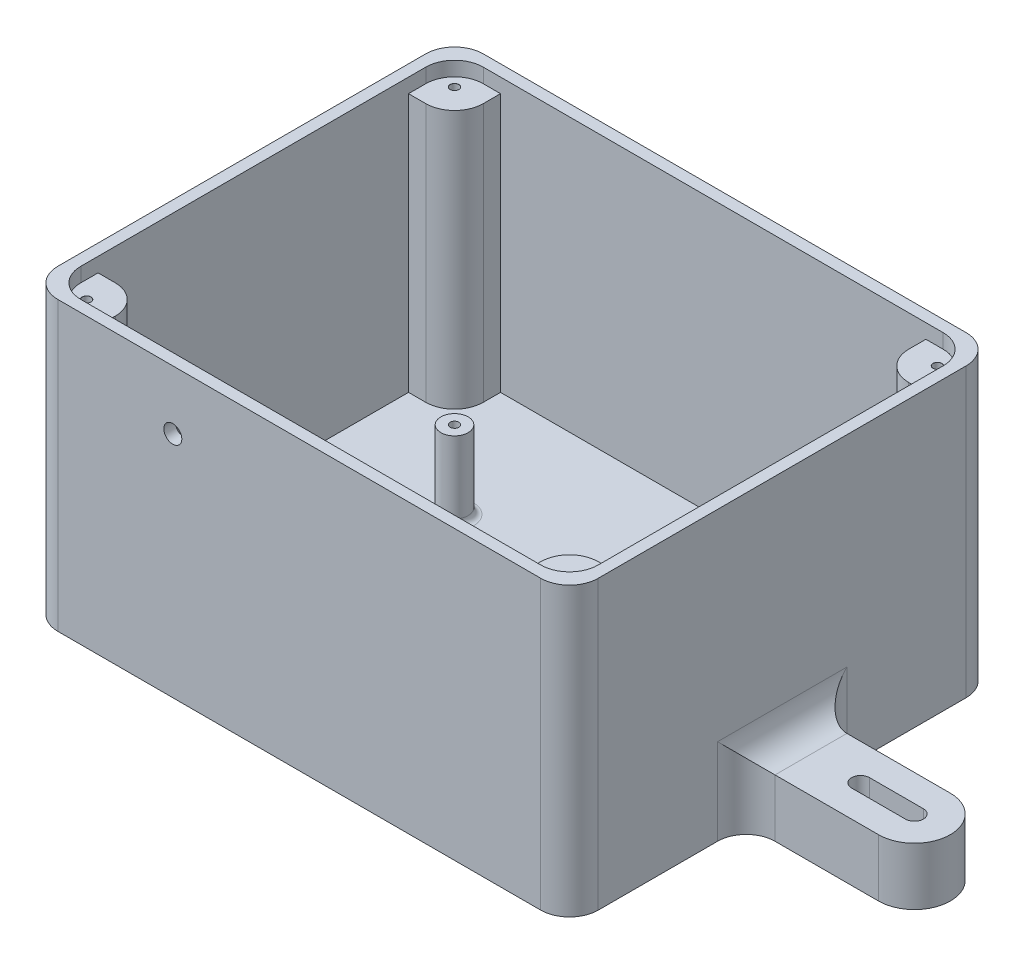
from build123d import *

# Parameters (mm, degrees)
ESBO_O1_W                                  = 4.75
ESBO_O1_H                                  = 1
REVOLU_O1_ANGLE                            = 180
ESBO_O2_W                                  = 9.5
ESBO_O2_H                                  = 74
RESSALTO_EXTRUS_O1_DEPTH                   = 8.75
ESBO_O3_W                                  = 8.75
ESBO_O3_H                                  = 73
CORTE_EXTRUS_O1_DEPTH                      = 1.5
ESBO_O4_W                                  = 8
ESBO_O4_H                                  = 73
CORTE_EXTRUS_O2_DEPTH                      = 4.75
ESBO_O5_W                                  = 4
ESBO_O5_H                                  = 68
RESSALTO_EXTRUS_O2_DEPTH                   = 52
ESBO_O6_W                                  = 4
ESBO_O6_H                                  = 74
RESSALTO_EXTRUS_O3_DEPTH                   = 80
ESBO_O7_W                                  = 4
ESBO_O7_H                                  = 74
RESSALTO_EXTRUS_O4_DEPTH                   = 40
ESBO_O8_W                                  = 144
ESBO_O8_H                                  = 74
RESSALTO_EXTRUS_O5_DEPTH                   = 4
ESBO_O9_W                                  = 144
ESBO_O9_H                                  = 74
RESSALTO_EXTRUS_O6_DEPTH                   = 4
ESBO_O10_W                                 = 188
ESBO_O10_H                                 = 74
RESSALTO_EXTRUS_O7_DEPTH                   = 4
ESBO_O11_W                                 = 188
ESBO_O11_H                                 = 148
RESSALTO_EXTRUS_O8_DEPTH                   = 26
CORTE_EXTRUS_O3_DEPTH                      = 21
RESSALTO_EXTRUS_O9_DEPTH                   = 20
CORTE_EXTRUS_O4_DEPTH                      = 268.847437919
RESSALTO_EXTRUS_O10_DEPTH                  = 20
CORTE_EXTRUS_O5_DEPTH                      = 262.040705638
ESBO_O17_W                                 = 16
ESBO_O17_H                                 = 16
RESSALTO_EXTRUS_O11_DEPTH                  = 90
ESBO_O18_W                                 = 16
ESBO_O18_H                                 = 16
RESSALTO_EXTRUS_O12_DEPTH                  = 90
ESBO_O19_W                                 = 16
ESBO_O19_H                                 = 16
RESSALTO_EXTRUS_O13_DEPTH                  = 90
ESBO_O20_W                                 = 16
ESBO_O20_H                                 = 16
RESSALTO_EXTRUS_O14_DEPTH                  = 90
RESSALTO_EXTRUS_O15_DEPTH                  = 22
ESBO_O22_W                                 = 4.75
ESBO_O22_H                                 = 22
FURO_DE_DI_METRO_3_0_3_1_D                 = 3
FURO_DE_DI_METRO_3_0_3_1_DEPTH             = 15
FURO_DE_DI_METRO_3_0_3_1_TIP               = 0.901290929
FURO_DE_DI_METRO_3_0_3_2_D                 = 3
FURO_DE_DI_METRO_3_0_3_2_DEPTH             = 15
FURO_DE_DI_METRO_3_0_3_2_TIP               = 0.901290929
BROCA_DE_ROSQUEAR_PARA_HELICOIDE_M61_D     = 6.25
BROCA_DE_ROSQUEAR_PARA_HELICOIDE_M61_DEPTH = 4
CHANFRO1_SIZE                              = 0.025
FILETE1_R                                  = 2
FILETE2_R                                  = 10
ESBO_O35_W                                 = 4.75
ESBO_O35_H                                 = 22
FILETE3_R                                  = 2
ESBO_O43_W                                 = 52
ESBO_O43_H                                 = 6
RESSALTO_EXTRUS_O16_DEPTH                  = 4
ESBO_O44_R                                 = 4.75
ESBO_O44_R_2                               = 1.525
RESSALTO_EXTRUS_O17_DEPTH                  = 5


with BuildPart() as part:
    # Esboço1 → Revolução1 (revolve)
    with BuildSketch(Plane.XY.offset(-4.75)):
        with Locations((97.625, 26.5)):
            Rectangle(ESBO_O1_W, ESBO_O1_H)
    revolve(axis=Axis((95.25, 27, -4.75), (0, 1, 0)), revolution_arc=REVOLU_O1_ANGLE)

    # Esboço2 → Ressalto-extrusão1 (add)
    with BuildSketch(Plane.XY.offset(-4.75)):
        with Locations((95.25, 63)):
            Rectangle(ESBO_O2_W, ESBO_O2_H)
    extrude(amount=RESSALTO_EXTRUS_O1_DEPTH)

    # Esboço3 → Corte-extrusão1 (cut)
    with BuildSketch(Plane.ZY.offset(-90.5)):
        with Locations((-0.375, 63.5)):
            Rectangle(ESBO_O3_W, ESBO_O3_H)
    extrude(amount=-CORTE_EXTRUS_O1_DEPTH, mode=Mode.SUBTRACT)

    # Esboço4 → Corte-extrusão2 (cut)
    with BuildSketch(Plane(origin=(0, 0, -4.75), x_dir=(-1, 0, 0), z_dir=(0, 0, -1))):
        with Locations((-96, 63.5)):
            Rectangle(ESBO_O4_W, ESBO_O4_H)
    extrude(amount=-CORTE_EXTRUS_O2_DEPTH, mode=Mode.SUBTRACT)

    # Esboço5 → Ressalto-extrusão2 (add)
    with BuildSketch(Plane.ZY.offset(-92)):
        with Locations((2, 66)):
            Rectangle(ESBO_O5_W, ESBO_O5_H)
    extrude(amount=RESSALTO_EXTRUS_O2_DEPTH)

    # Esboço6 → Ressalto-extrusão3 (add)
    with BuildSketch(Plane.ZY.offset(-40)):
        with Locations((2, 63)):
            Rectangle(ESBO_O6_W, ESBO_O6_H)
    extrude(amount=RESSALTO_EXTRUS_O3_DEPTH)

    # Esboço7 → Ressalto-extrusão4 (add)
    with BuildSketch(Plane(origin=(100, 0, 0), x_dir=(0, 0, -1), z_dir=(1, 0, 0))):
        with Locations((-2, 63)):
            Rectangle(ESBO_O7_W, ESBO_O7_H)
    extrude(amount=RESSALTO_EXTRUS_O4_DEPTH)

    # Esboço8 → Ressalto-extrusão5 (add)
    with BuildSketch(Plane(origin=(140, 0, 0), x_dir=(0, 0, -1), z_dir=(1, 0, 0))):
        with Locations((68, 63)):
            Rectangle(ESBO_O8_W, ESBO_O8_H)
    extrude(amount=RESSALTO_EXTRUS_O5_DEPTH)

    # Esboço9 → Ressalto-extrusão6 (add)
    with BuildSketch(Plane.ZY.offset(40)):
        with Locations((-68, 63)):
            Rectangle(ESBO_O9_W, ESBO_O9_H)
    extrude(amount=RESSALTO_EXTRUS_O6_DEPTH)

    # Esboço10 → Ressalto-extrusão7 (add)
    with BuildSketch(Plane(origin=(0, 0, -140), x_dir=(-1, 0, 0), z_dir=(0, 0, -1))):
        with Locations((-50, 63)):
            Rectangle(ESBO_O10_W, ESBO_O10_H)
    extrude(amount=RESSALTO_EXTRUS_O7_DEPTH)

    # Esboço11 → Ressalto-extrusão8 (add)
    with BuildSketch(Plane.XZ.offset(-26)):
        with Locations((50, -70)):
            Rectangle(ESBO_O11_W, ESBO_O11_H)
    extrude(amount=RESSALTO_EXTRUS_O8_DEPTH)

    # Esboço12 → Corte-extrusão3 (cut)
    with BuildSketch(Plane(origin=(0, 26, 0), x_dir=(-1, 0, 0), z_dir=(0, 1, 0))):
        with BuildLine():
            Line((-140, -140), (40, -140))
            Line((40, -140), (40, 0))
            Line((40, 0), (-90.5, 0))
            Line((-90.5, 0), (-90.5, -4.75))
            ThreePointArc((-90.5, -4.75), (-95.25, -9.5), (-100, -4.75))
            Line((-100, -4.75), (-100, 0))
            Line((-100, 0), (-140, 0))
            Line((-140, 0), (-140, -140))
        make_face()
    extrude(amount=-CORTE_EXTRUS_O3_DEPTH, mode=Mode.SUBTRACT)

    # Esboço13 → Ressalto-extrusão9 (add)
    with BuildSketch(Plane.XZ):
        with BuildLine():
            Line((144, -82.5), (190, -82.5))
            ThreePointArc((190, -82.5), (202.5, -70), (190, -57.5))
            Line((190, -57.5), (144, -57.5))
            Line((144, -57.5), (144, -82.5))
        make_face()
    extrude(amount=-RESSALTO_EXTRUS_O9_DEPTH)

    # Esboço14 → Corte-extrusão4 (cut, through all)
    with BuildSketch(Plane.XZ):
        with BuildLine():
            Line((190, -66.875), (171.25, -66.875))
            ThreePointArc((171.25, -66.875), (168.125, -70), (171.25, -73.125))
            Line((171.25, -73.125), (190, -73.125))
            ThreePointArc((190, -73.125), (193.125, -70), (190, -66.875))
        make_face()
    extrude(amount=-CORTE_EXTRUS_O4_DEPTH, mode=Mode.SUBTRACT)

    # Esboço15 → Ressalto-extrusão10 (add)
    with BuildSketch(Plane.XZ):
        with BuildLine():
            Line((-44, -57.5), (-90, -57.5))
            ThreePointArc((-90, -57.5), (-102.5, -70), (-90, -82.5))
            Line((-90, -82.5), (-44, -82.5))
            Line((-44, -82.5), (-44, -57.5))
        make_face()
    extrude(amount=-RESSALTO_EXTRUS_O10_DEPTH)

    # Esboço16 → Corte-extrusão5 (cut, through all)
    with BuildSketch(Plane(origin=(0, 20, 0), x_dir=(-1, 0, 0), z_dir=(0, 1, 0))):
        with BuildLine():
            Line((71.25, -73.125), (90, -73.125))
            ThreePointArc((90, -73.125), (93.125, -70), (90, -66.875))
            Line((90, -66.875), (71.25, -66.875))
            ThreePointArc((71.25, -66.875), (68.125, -70), (71.25, -73.125))
        make_face()
    extrude(amount=-CORTE_EXTRUS_O5_DEPTH, mode=Mode.SUBTRACT)

    # Esboço17 → Ressalto-extrusão11 (add)
    with BuildSketch(Plane(origin=(0, 5, 0), x_dir=(-1, 0, 0), z_dir=(0, 1, 0))):
        with Locations((32, -132)):
            Rectangle(ESBO_O17_W, ESBO_O17_H)
    extrude(amount=RESSALTO_EXTRUS_O11_DEPTH)

    # Esboço18 → Ressalto-extrusão12 (add)
    with BuildSketch(Plane(origin=(0, 5, 0), x_dir=(-1, 0, 0), z_dir=(0, 1, 0))):
        with Locations((-132, -132)):
            Rectangle(ESBO_O18_W, ESBO_O18_H)
    extrude(amount=RESSALTO_EXTRUS_O12_DEPTH)

    # Esboço19 → Ressalto-extrusão13 (add)
    with BuildSketch(Plane(origin=(0, 5, 0), x_dir=(-1, 0, 0), z_dir=(0, 1, 0))):
        with Locations((-132, -8)):
            Rectangle(ESBO_O19_W, ESBO_O19_H)
    extrude(amount=RESSALTO_EXTRUS_O13_DEPTH)

    # Esboço20 → Ressalto-extrusão14 (add)
    with BuildSketch(Plane(origin=(0, 5, 0), x_dir=(-1, 0, 0), z_dir=(0, 1, 0))):
        with Locations((32, -8)):
            Rectangle(ESBO_O20_W, ESBO_O20_H)
    extrude(amount=RESSALTO_EXTRUS_O14_DEPTH)

    # Esboço21 → Ressalto-extrusão15 (add)
    with BuildSketch(Plane(origin=(0, 5, 0), x_dir=(-1, 0, 0), z_dir=(0, 1, 0))):
        with BuildLine():
            Line((-9.5, -4.75), (-9.5, 0))
            Line((-9.5, 0), (0, 0))
            Line((0, 0), (0, -4.75))
            ThreePointArc((0, -4.75), (-4.75, -9.5), (-9.5, -4.75))
        make_face()
    extrude(amount=RESSALTO_EXTRUS_O15_DEPTH)

    # Esboço22 → Revolução2 (revolve)
    with BuildSketch(Plane.XY.offset(-95.25), mode=Mode.PRIVATE) as revolu_o2_sk:
        with Locations((7.125, 16)):
            Rectangle(ESBO_O22_W, ESBO_O22_H)
    revolve(revolu_o2_sk.sketch.rotate(Axis((4.75, 27, -95.25), (0, -1, 0)), 270), axis=Axis((4.75, 27, -95.25), (0, -1, 0)))

    # Furo de diâmetro Ø3.0 (3)1
    with Locations(Plane(origin=(0, 95, 0), x_dir=(1, 0, 0), z_dir=(0, 1, 0))):
        with Locations((-34, 6), (134, 6), (134, 134), (-34, 134)):
            Hole(FURO_DE_DI_METRO_3_0_3_1_D / 2, depth=FURO_DE_DI_METRO_3_0_3_1_DEPTH)
            with Locations((0, 0, -(FURO_DE_DI_METRO_3_0_3_1_DEPTH + FURO_DE_DI_METRO_3_0_3_1_TIP / 2))):  # 118° drill point
                Cone(0, FURO_DE_DI_METRO_3_0_3_1_D / 2, FURO_DE_DI_METRO_3_0_3_1_TIP, mode=Mode.SUBTRACT)

    # Furo de diâmetro Ø3.0 (3)2
    with Locations(Plane(origin=(0, 27, 0), x_dir=(1, 0, 0), z_dir=(0, 1, 0))):
        with Locations((95.25, 4.75), (4.75, 4.75), (4.75, 95.25)):
            Hole(FURO_DE_DI_METRO_3_0_3_2_D / 2, depth=FURO_DE_DI_METRO_3_0_3_2_DEPTH)
            with Locations((0, 0, -(FURO_DE_DI_METRO_3_0_3_2_DEPTH + FURO_DE_DI_METRO_3_0_3_2_TIP / 2))):  # 118° drill point
                Cone(0, FURO_DE_DI_METRO_3_0_3_2_D / 2, FURO_DE_DI_METRO_3_0_3_2_TIP, mode=Mode.SUBTRACT)

    # Broca de rosquear para helicoide M61
    with Locations(Plane.XY.offset(4)):
        with Locations((6, 79.5)):
            Hole(BROCA_DE_ROSQUEAR_PARA_HELICOIDE_M61_D / 2, depth=BROCA_DE_ROSQUEAR_PARA_HELICOIDE_M61_DEPTH)

    # Chanfro1
    chanfro1_edges = [part.edges().sort_by_distance(p)[0] for p in [
        (-32.5, 95, -134),
        (135.5, 95, -134),
        (135.5, 95, -6),
        (-32.5, 95, -6),
        (6.25, 27, -95.25),
        (6.25, 27, -4.75),
        (96.75, 27, -4.75),
    ]]
    chamfer(chanfro1_edges, length=CHANFRO1_SIZE)

    # Filete1
    filete1_edges = [part.edges().sort_by_distance(p)[0] for p in [
        (92, 32, 2),
        (40, 32, 2),
        (40, 26, 2),
    ]]
    fillet(filete1_edges, radius=FILETE1_R)

    # Filete2
    filete2_edges = [part.edges().sort_by_distance(p)[0] for p in [
        (-40, 97.5, -140),
        (-44, 50, 4),
        (-44, 50, -144),
        (144, 50, -144),
        (144, 20, -70),
        (144, 10, -82.5),
        (144, 10, -57.5),
        (-44, 20, -70),
        (-44, 10, -57.5),
        (-44, 10, -82.5),
        (-24, 50, -124),
        (140, 97.5, -140),
        (124, 50, -124),
        (140, 97.5, 0),
        (124, 50, -16),
        (-24, 50, -16),
        (-40, 97.5, 0),
        (144, 50, 4),
    ]]
    fillet(filete2_edges, radius=FILETE2_R)

    # Esboço35 → Revolução3 (revolve)
    with BuildSketch(Plane.XY.offset(-95.25), mode=Mode.PRIVATE) as revolu_o3_sk:
        with Locations((97.625, 16)):
            Rectangle(ESBO_O35_W, ESBO_O35_H)
    revolve(revolu_o3_sk.sketch.rotate(Axis((95.25, 27, -95.25), (0, -1, 0)), 270), axis=Axis((95.25, 27, -95.25), (0, -1, 0)))

    # Esboço42 → Corte-Revolução1 (revolve, cut)
    with BuildSketch(Plane.XY.offset(-95.25), mode=Mode.PRIVATE) as corte_revolu_o1_sk:
        Polygon((96.775, 27), (95.25, 27), (95.25, 11.098709071), (96.75, 12), (96.75, 26.975), align=None)
    revolve(corte_revolu_o1_sk.sketch.rotate(Axis((95.25, 27, -95.25), (0, -1, 0)), 270), axis=Axis((95.25, 27, -95.25), (0, -1, 0)), mode=Mode.SUBTRACT)

    # Filete3
    filete3_edges = [part.edges().sort_by_distance(p)[0] for p in [
        (100, 5, -2.375),
        (95.25, 5, -9.5),
        (90.5, 5, -2.375),
        (4.75, 5, -9.5),
        (0, 5, -2.375),
        (9.5, 5, -2.375),
        (4.75, 5, -90.5),
        (95.25, 5, -90.5),
    ]]
    fillet(filete3_edges, radius=FILETE3_R)

    # Esboço43 → Ressalto-extrusão16 (add)
    with BuildSketch(Plane.XY.offset(4)):
        with Locations((66, 29)):
            Rectangle(ESBO_O43_W, ESBO_O43_H)
    extrude(amount=-RESSALTO_EXTRUS_O16_DEPTH)

    # Esboço44 → Ressalto-extrusão17 (add, symmetric)
    # profile 1 of 4: a face of its own
    with BuildSketch(Plane(origin=(0, 27, 0), x_dir=(-1, 0, 0), z_dir=(0, 1, 0))):
        with Locations(Location((-4.75, -95.25, 0), (0, 0, 270))):
            Circle(ESBO_O44_R)
        with Locations(Location((-4.75, -95.25, 0), (0, 0, 90))):
            Circle(ESBO_O44_R_2, mode=Mode.SUBTRACT)
    # profile 2 of 4: a face of its own
    with BuildSketch(Plane(origin=(0, 27, 0), x_dir=(-1, 0, 0), z_dir=(0, 1, 0))):
        with Locations(Location((-95.25, -95.25, 0), (0, 0, 270))):
            Circle(ESBO_O44_R)
        with Locations(Location((-95.25, -95.25, 0), (0, 0, 270))):
            Circle(ESBO_O44_R_2, mode=Mode.SUBTRACT)
    # profile 3 of 4: a face of its own
    with BuildSketch(Plane(origin=(0, 27, 0), x_dir=(-1, 0, 0), z_dir=(0, 1, 0))):
        with BuildLine():
            Line((-9.5, -4.75), (-9.5, 0))
            Line((-9.5, 0), (0, 0))
            Line((0, 0), (0, -4.75))
            ThreePointArc((0, -4.75), (-4.75, -9.5), (-9.5, -4.75))
        make_face()
        with Locations(Location((-4.75, -4.75, 0), (0, 0, 270))):
            Circle(ESBO_O44_R_2, mode=Mode.SUBTRACT)
    # profile 4 of 4: a face of its own
    with BuildSketch(Plane(origin=(0, 27, 0), x_dir=(-1, 0, 0), z_dir=(0, 1, 0))):
        with BuildLine():
            Line((-100, 0), (-100, -4.75))
            ThreePointArc((-100, -4.75), (-95.25, -9.5), (-90.5, -4.75))
            Line((-90.5, -4.75), (-90.5, 0))
            Line((-90.5, 0), (-100, 0))
        make_face()
        with Locations(Location((-95.25, -4.75, 0), (0, 0, 90))):
            Circle(ESBO_O44_R_2, mode=Mode.SUBTRACT)
    extrude(amount=RESSALTO_EXTRUS_O17_DEPTH, both=True)


solid = part.part
